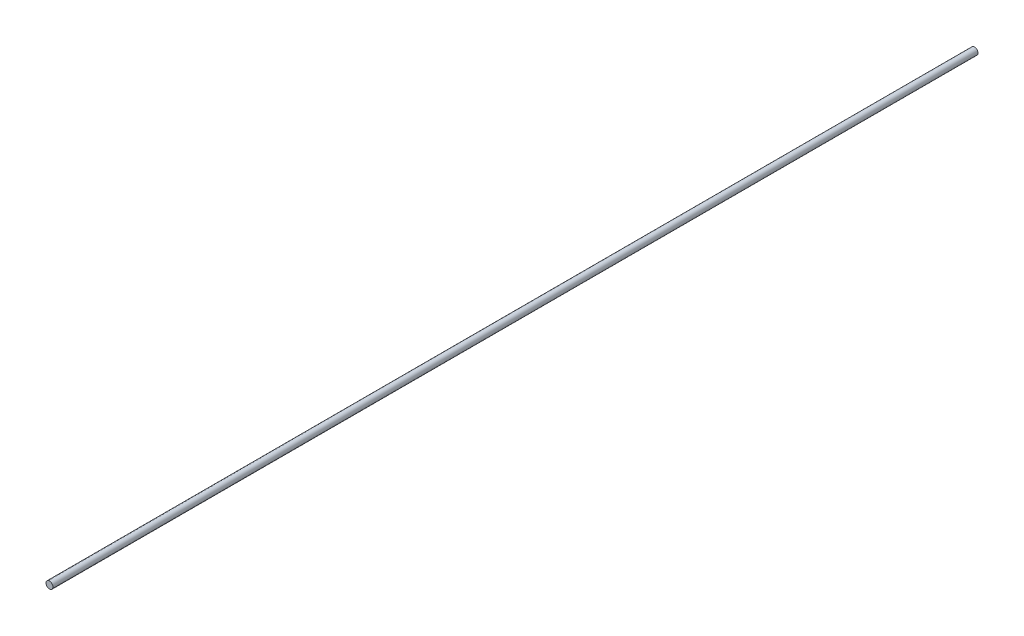
from build123d import *

# Parameters (mm, degrees)
SKETCH1_R           = 1.5
BOSS_EXTRUDE1_DEPTH = 400


with BuildPart() as part:
    # Sketch1 → Boss-Extrude1 (new body)
    with BuildSketch(Plane.XY):
        Circle(SKETCH1_R)
    extrude(amount=BOSS_EXTRUDE1_DEPTH)


solid = part.part
